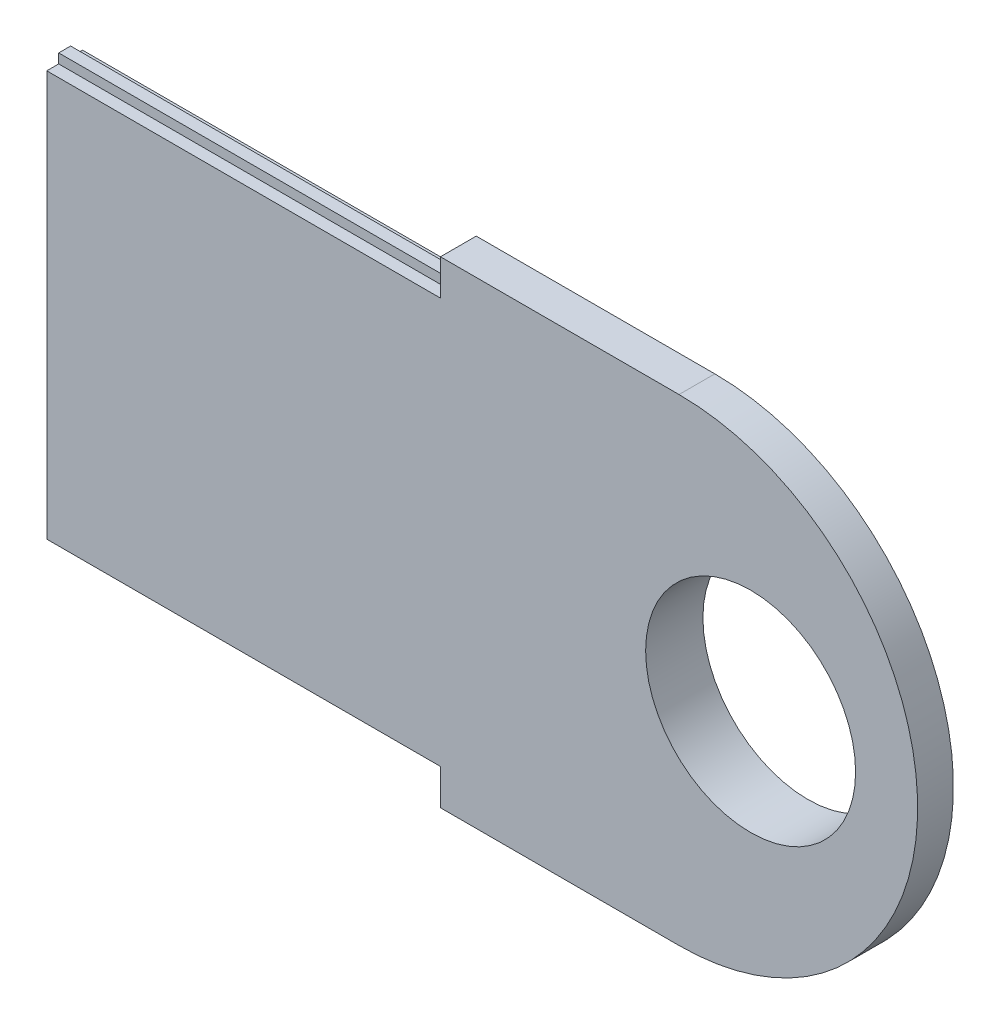
from build123d import *

# Parameters (mm, degrees)
SKETCH1_R           = 11.176
BOSS_EXTRUDE1_DEPTH = 3.81
SKETCH2_W           = 41.91
SKETCH2_H           = 1.27
BOSS_EXTRUDE2_DEPTH = 1.016
BOSS_EXTRUDE4_START = 2.286
SKETCH4_R           = 13.716
SKETCH4_R_2         = 11.176
BOSS_EXTRUDE4_DEPTH = 2.286


with BuildPart() as part:
    # Sketch1 → Boss-Extrude1 (new body)
    with BuildSketch(Plane.XY):
        with BuildLine():
            Line((20.955, -25.4), (20.955, -21.59))
            Line((20.955, -21.59), (-20.955, -21.59))
            Line((-20.955, -21.59), (-20.955, 21.59))
            Line((-20.955, 21.59), (20.955, 21.59))
            Line((20.955, 21.59), (20.955, 25.4))
            Line((20.955, 25.4), (46.355, 25.4))
            ThreePointArc((46.355, 25.4), (71.755, 0), (46.355, -25.4))
            Line((46.355, -25.4), (20.955, -25.4))
        make_face()
        with Locations(Location((53.975, 0, 0), (0, 0, 180))):
            Circle(SKETCH1_R, mode=Mode.SUBTRACT)
    extrude(amount=BOSS_EXTRUDE1_DEPTH)

    # Sketch2 → Boss-Extrude2 (add)
    with BuildSketch(Plane.XZ.offset(21.59)):
        with Locations((0, 1.905)):
            Rectangle(SKETCH2_W, SKETCH2_H)
    boss_extrude2 = extrude(amount=BOSS_EXTRUDE2_DEPTH)

    # Mirror1: Boss-Extrude2 across plane
    add(boss_extrude2.mirror(Plane.ZX))

    # Sketch4 → Boss-Extrude4 (add)
    with BuildSketch(Plane(origin=(0, 0, 0), x_dir=(-1, 0, 0), z_dir=(0, 0, -1)).offset(BOSS_EXTRUDE4_START)):
        with Locations((-53.975, 0)):
            Circle(SKETCH4_R)
        with Locations((-53.975, 0)):
            Circle(SKETCH4_R_2, mode=Mode.SUBTRACT)
    extrude(amount=-BOSS_EXTRUDE4_DEPTH)


solid = part.part
